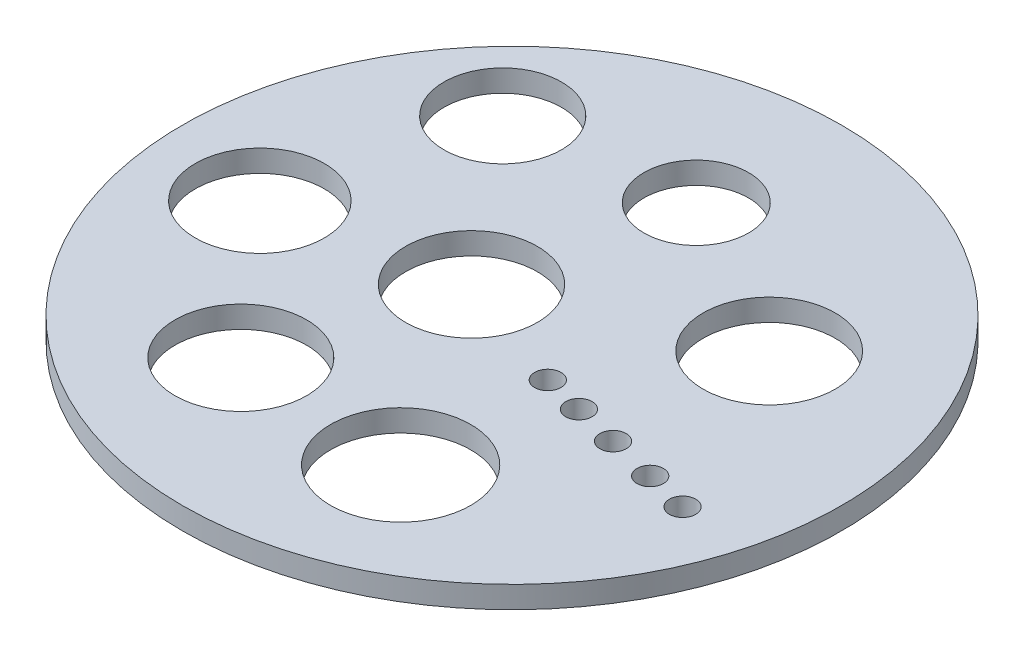
from build123d import *

# Parameters (mm, degrees)
SKETCH1_R           = 15
BOSS_EXTRUDE1_DEPTH = 1
SKETCH2_R           = 0.6
SKETCH2_R_2         = 3.006901917
SKETCH2_R_3         = 3.191746329
SKETCH2_R_4         = 2.382117141
SKETCH2_R_5         = 3
SKETCH2_R_6         = 2.995399962
SKETCH2_R_7         = 2.675737647
SKETCH2_R_8         = 2.937929851
CUT_EXTRUDE2_DEPTH  = 23.95290922


with BuildPart() as part:
    # Sketch1 → Boss-Extrude1 (new body)
    with BuildSketch(Plane(origin=(0, 0, 0), x_dir=(1, 0, 0), z_dir=(0, 1, 0))):
        with Locations(Location((-1.207669286, 1.22182166, 0), (0, 0, 270))):
            Circle(SKETCH1_R)
    extrude(amount=BOSS_EXTRUDE1_DEPTH)

    # Sketch2 → Cut-Extrude2 (cut, through all)
    with BuildSketch(Plane(origin=(0, 1, 0), x_dir=(1, 0, 0), z_dir=(0, 1, 0))):
        with Locations(Location((2.155419287, -0.512260871, 0), (0, 0, 270))):
            Circle(SKETCH2_R)
        with Locations(Location((8.27073273, -1.965637393, 0), (0, 0, 270))):
            Circle(SKETCH2_R)
        with Locations(Location((6.052247723, -1.438388209, 0), (0, 0, 270))):
            Circle(SKETCH2_R)
        with Locations(Location((4.014941627, -0.954198334, 0), (0, 0, 270))):
            Circle(SKETCH2_R)
        with Locations(Location((10.220480742, -2.443193561, 0), (0, 0, 270))):
            Circle(SKETCH2_R)
        with Locations(Location((6.052247723, 5.667666543, 0), (0, 0, 270))):
            Circle(SKETCH2_R_2)
        with Locations(Location((2.155419287, -7.210198726, 0), (0, 0, 270))):
            Circle(SKETCH2_R_3)
        with Locations(Location((-1.450571509, 9.851420656, 0), (0, 0, 270))):
            Circle(SKETCH2_R_4)
        with Locations(Location((-3.348379364, 1.518569664, 0), (0, 0, 270))):
            Circle(SKETCH2_R_5)
        with Locations(Location((-5.706393317, -6.623254074, 0), (0, 0, 270))):
            Circle(SKETCH2_R_6)
        with Locations(Location((-9.280192729, 8.871767255, 0), (0, 0, 270))):
            Circle(SKETCH2_R_7)
        with Locations(Location((-11.463699415, 0, 0), (0, 0, 270))):
            Circle(SKETCH2_R_8)
    extrude(amount=-CUT_EXTRUDE2_DEPTH, mode=Mode.SUBTRACT)


solid = part.part
